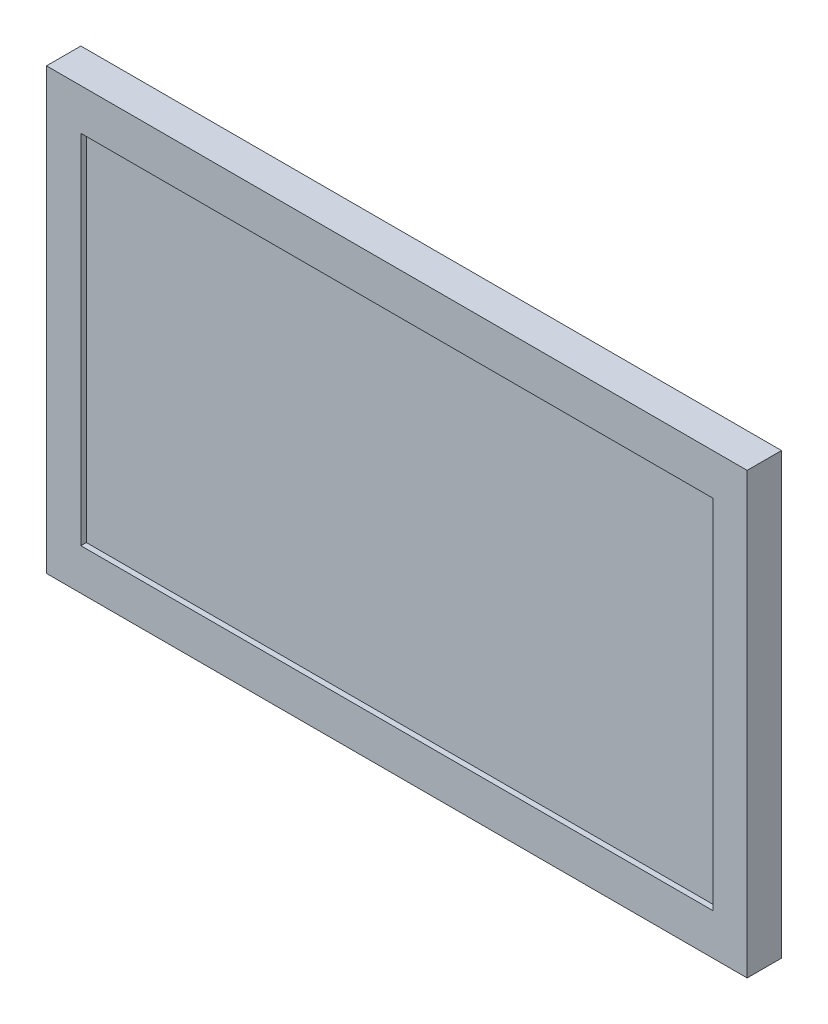
from build123d import *

# Parameters (mm, degrees)
SKETCH1_W           = 323.85
SKETCH1_H           = 203.2
BOSS_EXTRUDE1_DEPTH = 15.875
SKETCH2_W           = 292.1
SKETCH2_H           = 165.1
CUT_EXTRUDE1_DEPTH  = 2.54


with BuildPart() as part:
    # Sketch1 → Boss-Extrude1 (new body)
    with BuildSketch(Plane.XY):
        Rectangle(SKETCH1_W, SKETCH1_H)
    extrude(amount=BOSS_EXTRUDE1_DEPTH)

    # Sketch2 → Cut-Extrude1 (cut)
    with BuildSketch(Plane.XY.offset(15.875)):
        Rectangle(SKETCH2_W, SKETCH2_H)
    extrude(amount=-CUT_EXTRUDE1_DEPTH, mode=Mode.SUBTRACT)


solid = part.part
